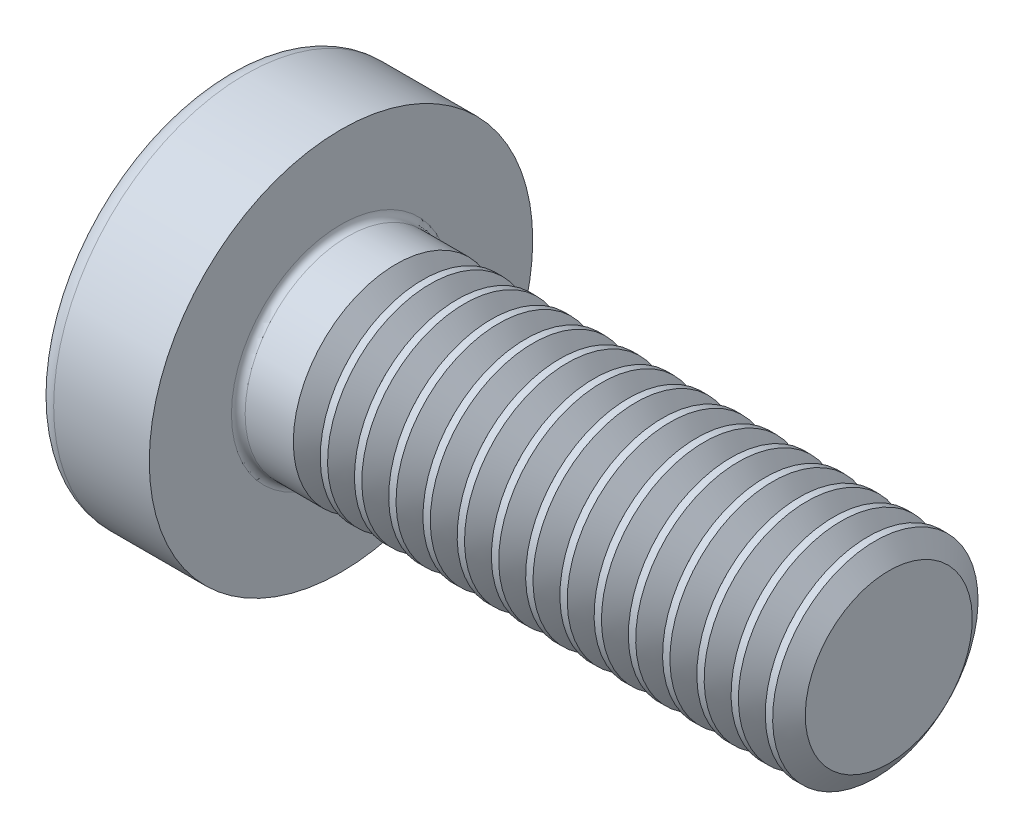
from build123d import *

# Parameters (mm, degrees)
FILLET1_R       = 0.1
RECPAT_COUNT    = 2
RECPAT_ANGLE    = 90
THDSCHPAT_COUNT = 15
THDSCHPAT_PITCH = 0.5


with BuildPart() as part:
    # BodySke → Base-Revolve (revolve)
    with BuildSketch(Plane.XY, mode=Mode.PRIVATE) as base_revolve_sk:
        with BuildLine():
            Line((2.4, 1.5), (2.4, 2.8))
            Line((2.4, 2.8), (1.003501533, 2.8))
            ThreePointArc((1.003501533, 2.8), (0.873295971, 2.76653015), (0.775371599, 2.674418605))
            ThreePointArc((0.775371599, 2.674418605), (0.197753546, 1.392274756), (0, 0))
            Line((0, 0), (10.4, 0))
            Line((10.4, 0), (10.4, 1.5))
            Line((10.4, 1.5), (2.4, 1.5))
        make_face()
    revolve(base_revolve_sk.sketch.rotate(Axis((1.003501533, 0, 0), (1, 0, 0)), 90), axis=Axis((1.003501533, 0, 0), (1, 0, 0)))

    # Fillet1
    fillet1_edges = [part.edges().sort_by_distance(p)[0] for p in [
        (2.4, 0, -1.5),
    ]]
    fillet(fillet1_edges, radius=FILLET1_R)

    # Sketch3 → Recess section 0
    with BuildSketch(Plane(origin=(0, 0, 0), x_dir=(0, 0, -1), z_dir=(1, 0, 0))):
        with BuildLine():
            Line((0.37, -1.4), (-0.37, -1.4))
            Line((-0.37, -1.4), (-0.37, 1.4))
            Line((-0.37, 1.4), (0.37, 1.4))
            Line((0.37, 1.4), (0.37, -1.4))
        make_face()
    # Sketch4 → Recess section 1
    with BuildSketch(Plane(origin=(1.75, 0, 0), x_dir=(0, 0, -1), z_dir=(1, 0, 0))):
        with BuildLine():
            Line((0.37, -0.527482216), (-0.37, -0.527482216))
            Line((-0.37, -0.527482216), (-0.37, 0.527482216))
            Line((-0.37, 0.527482216), (0.37, 0.527482216))
            Line((0.37, 0.527482216), (0.37, -0.527482216))
        make_face()
    recess = loft(mode=Mode.SUBTRACT)

    # RecPat: Recess ×2 about axis
    recpat_axis = Axis((0, 0, 0), (1, 0, 0))
    for i in range(1, RECPAT_COUNT):
        add(recess.rotate(recpat_axis, i * RECPAT_ANGLE / (RECPAT_COUNT - 1)), mode=Mode.SUBTRACT)

    # RecCorSke → RecessCore (revolve, cut)
    with BuildSketch(Plane.XY, mode=Mode.PRIVATE) as recesscore_sk:
        Polygon((0, 0), (0, 0.678371921), (1.75, 0.556), (1.930655351, 0), align=None)
    revolve(recesscore_sk.sketch.rotate(Axis((-3.175, 0, 0), (1, 0, 0)), 15.814025764), axis=Axis((-3.175, 0, 0), (1, 0, 0)), mode=Mode.SUBTRACT)

    # ThdSchSke → ThreadSchematic (revolve, cut)
    with BuildSketch(Plane.XY, mode=Mode.PRIVATE) as threadschematic_sk:
        Polygon((3.4, -1.2195), (3.203591786, -1.5), (3.203591786, -1.875), (3.596408214, -1.875), (3.596408214, -1.5), align=None)
    threadschematic = revolve(threadschematic_sk.sketch.rotate(Axis((-3.175, 0, 0), (1, 0, 0)), 270), axis=Axis((-3.175, 0, 0), (1, 0, 0)), mode=Mode.SUBTRACT)

    # ThdSchPat: ThreadSchematic ×15
    with Locations(*[(i * THDSCHPAT_PITCH, 0, 0) for i in range(1, THDSCHPAT_COUNT)]):
        add(threadschematic, mode=Mode.SUBTRACT)


solid = part.part
